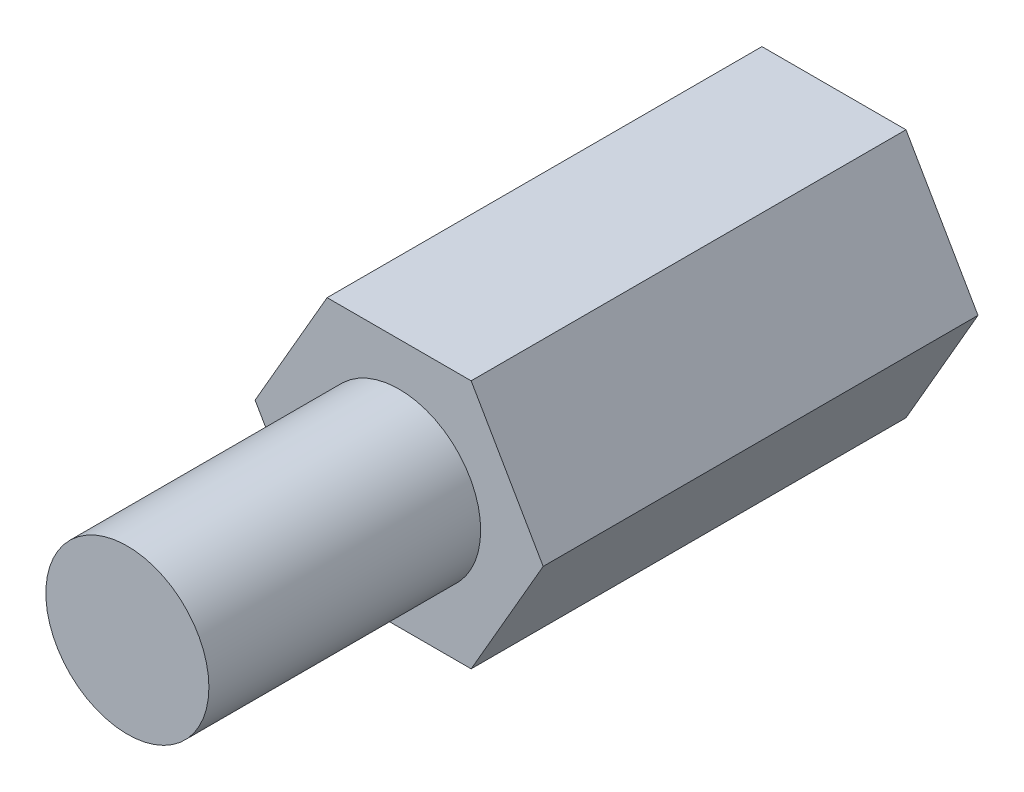
from build123d import *

# Parameters (mm, degrees)
EXTRUDE_1_DEPTH     = 8
SKETCH_2_R          = 1.25
CUT_EXTRUDE_1_DEPTH = 3
SKETCH_3_R          = 1.5
EXTRUDE_2_DEPTH     = 5


with BuildPart() as part:
    # 草圖1 → 填料-伸長1 (new body)
    with BuildSketch(Plane.XY):
        Polygon((1.325, 2.29496732), (-1.325, 2.29496732), (-2.65, 0), (-1.325, -2.29496732), (1.325, -2.29496732), (2.65, 0), align=None)
    extrude(amount=EXTRUDE_1_DEPTH)

    # 草圖2 → 除料-伸長1 (cut)
    with BuildSketch(Plane(origin=(0, 0, 0), x_dir=(-1, 0, 0), z_dir=(0, 0, -1))):
        Circle(SKETCH_2_R)
    extrude(amount=-CUT_EXTRUDE_1_DEPTH, mode=Mode.SUBTRACT)

    # 草圖3 → 填料-伸長2 (add)
    with BuildSketch(Plane.XY.offset(8)):
        Circle(SKETCH_3_R)
    extrude(amount=EXTRUDE_2_DEPTH)


solid = part.part
